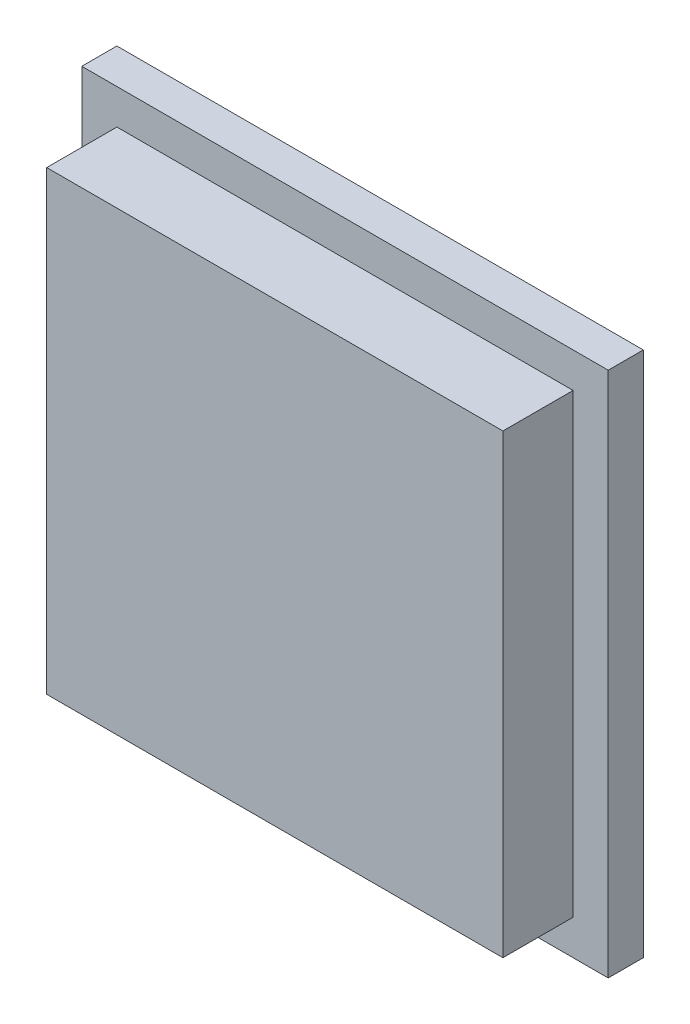
from build123d import *

# Parameters (mm, degrees)
SKETCH1_W           = 150
SKETCH1_H           = 150
BOSS_EXTRUDE1_DEPTH = 10
SKETCH2_W           = 130
SKETCH2_H           = 130
BOSS_EXTRUDE2_DEPTH = 20


with BuildPart() as part:
    # Sketch1 → Boss-Extrude1 (new body)
    with BuildSketch(Plane.XY):
        with Locations((75, 75)):
            Rectangle(SKETCH1_W, SKETCH1_H)
    extrude(amount=BOSS_EXTRUDE1_DEPTH)

    # Sketch2 → Boss-Extrude2 (add)
    with BuildSketch(Plane.XY.offset(10)):
        with Locations((75, 75)):
            Rectangle(SKETCH2_W, SKETCH2_H)
    extrude(amount=BOSS_EXTRUDE2_DEPTH)


solid = part.part
